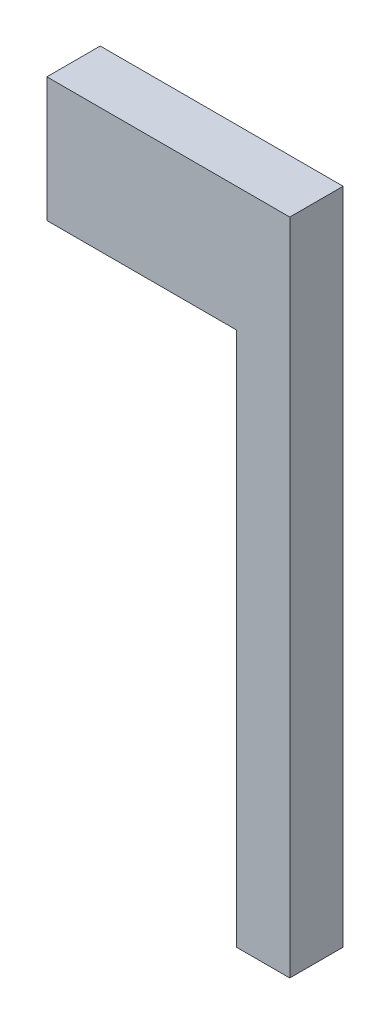
from build123d import *

# Parameters (mm, degrees)
BOSS_EXTRUDE2_DEPTH = 3


with BuildPart() as part:
    # Sketch1 → Boss-Extrude2 (new body)
    with BuildSketch(Plane.XY):
        Polygon((-10.576666667, -18.924170241), (-10.576666667, -11.924170241), (3.083333333, -11.924170241), (3.083333333, -48.984170241), (0.083333333, -48.984170241), (0.083333333, -18.924170241), align=None)
    extrude(amount=BOSS_EXTRUDE2_DEPTH)


solid = part.part
